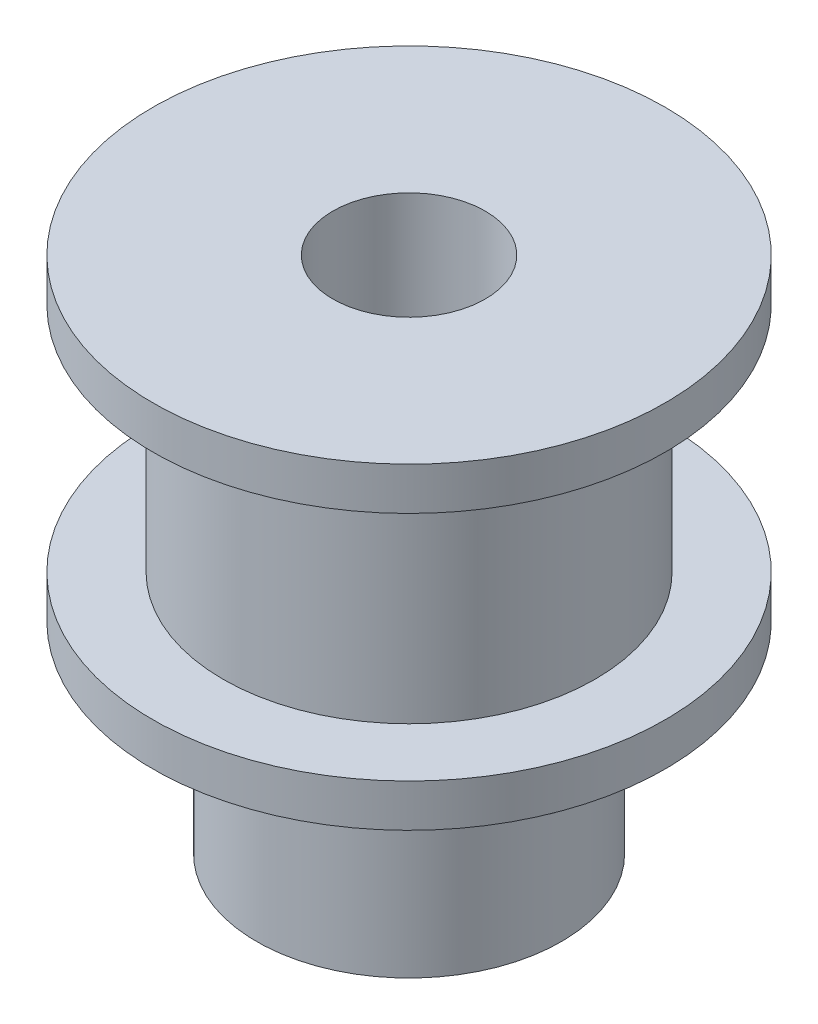
from build123d import *

# Parameters (mm, degrees)
CORTAR_EXTRUIR1_REACH      = 22.739
CORTAR_EXTRUIR1_END_RADIUS = 5
CROQUIS2_R                 = 1.25
MATRIZC1_COUNT             = 2
MATRIZC1_ANGLE             = 90


with BuildPart() as part:
    # Croquis1 → Revolución1 (revolve)
    with BuildSketch(Plane.XY, mode=Mode.PRIVATE) as revoluci_n1_sk:
        Polygon((8.4, 6.6), (5, 6.6), (5, 0), (2.5, 0), (2.5, 17), (8.4, 17), (8.4, 15.6), (6.1, 15.6), (6.1, 8), (8.4, 8), align=None)
    revolve(revoluci_n1_sk.sketch.rotate(Axis((0, 0, 0), (0, 1, 0)), 90), axis=Axis((0, 0, 0), (0, 1, 0)))

    # Cortar-Extruir1: up to this cylinder (the profile starts inside it)
    cortar_extruir1_end = Plane(origin=(0, 5, 0), z_dir=(0, -1, 0)) * Cylinder(CORTAR_EXTRUIR1_END_RADIUS, 56.478, mode=Mode.PRIVATE)
    # Croquis2 → Cortar-Extruir1 (cut, up to the surface)
    with BuildSketch(Plane.XY, mode=Mode.PRIVATE) as cortar_extruir1_sk1:
        with Locations((0, 5)):
            Circle(CROQUIS2_R)
    cortar_extruir1_tool1 = extrude(cortar_extruir1_sk1.sketch, amount=-CORTAR_EXTRUIR1_REACH, mode=Mode.PRIVATE) & cortar_extruir1_end
    cortar_extruir1 = cortar_extruir1_tool1.solids().sort_by_distance((0, 5, 0))[0]
    add(cortar_extruir1, mode=Mode.SUBTRACT)

    # MatrizC1: Cortar-Extruir1 ×2 about axis
    matrizc1_axis = Axis((0, 0, 0), (0, -1, 0))
    for i in range(1, MATRIZC1_COUNT):
        add(cortar_extruir1.rotate(matrizc1_axis, i * MATRIZC1_ANGLE / (MATRIZC1_COUNT - 1)), mode=Mode.SUBTRACT)


solid = part.part
